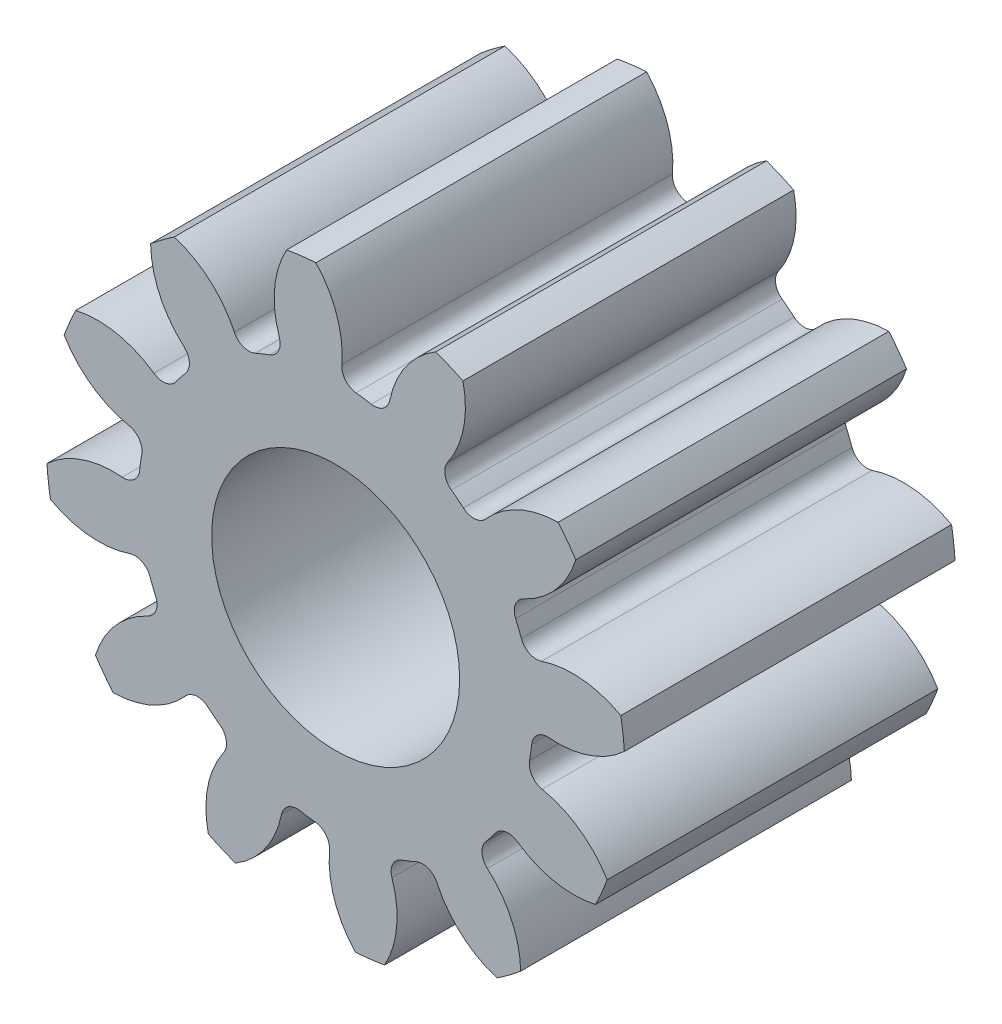
from build123d import *

# Parameters (mm, degrees)
SKETCH3_R         = 11.1125
GEARBODY_DEPTH    = 12.7
TOOTHCUT_DEPTH    = 21.205576272
CIRPATTERN1_COUNT = 12
BOREDIA_R         = 4.7625
BORE_DEPTH        = 12700


with BuildPart() as part:
    # Sketch3 → gearBody (new body)
    with BuildSketch(Plane.XY):
        Circle(SKETCH3_R)
    extrude(amount=GEARBODY_DEPTH)

    # Sketch2 → toothCut (cut, through all)
    with BuildSketch(Plane.XY):
        with BuildLine():
            ThreePointArc((7.444754533, -1.366901089), (7.492243976, -1.076600595), (7.528417841, -0.784674105))
            ThreePointArc((7.528417841, -0.784674105), (7.748332797, -0.374598545), (8.192629287, -0.236304722))
            ThreePointArc((8.192629287, -0.236304722), (10.138992771, 0.11400759), (11.641974978, 1.399345683))
            ThreePointArc((11.641974978, 1.399345683), (11.606557001, -1.667808231), (10.77690315, -4.620834146))
            ThreePointArc((10.77690315, -4.620834146), (9.696654608, -2.964297816), (7.927683168, -2.080109164))
            ThreePointArc((7.927683168, -2.080109164), (7.540303773, -1.822307386), (7.444754533, -1.366901089))
        make_face()
    toothcut = extrude(amount=TOOTHCUT_DEPTH, mode=Mode.SUBTRACT)

    # CirPattern1: toothCut ×12 about axis
    cirpattern1_axis = Axis((0, 0, 0), (0, 0, 1))
    for i in range(1, CIRPATTERN1_COUNT):
        add(toothcut.rotate(cirpattern1_axis, i * 360 / CIRPATTERN1_COUNT), mode=Mode.SUBTRACT)

    # boreDia → bore (cut, symmetric)
    with BuildSketch(Plane.XY):
        Circle(BOREDIA_R)
    extrude(amount=BORE_DEPTH, both=True, mode=Mode.SUBTRACT)


solid = part.part
